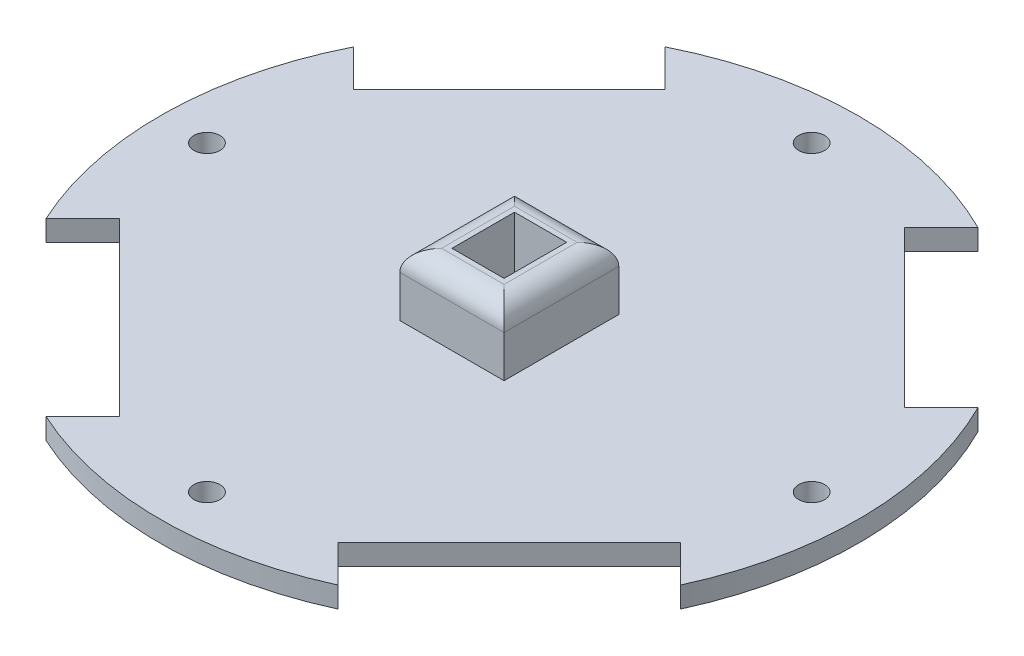
from build123d import *

# Parameters (mm, degrees)
SKETCH1_R           = 67
SKETCH1_R_2         = 2.5
BOSS_EXTRUDE1_DEPTH = 4
SKETCH2_R           = 2
CUT_EXTRUDE1_DEPTH  = 4
SKETCH4_W           = 20
SKETCH4_H           = 22
SKETCH4_W_2         = 10
SKETCH4_H_2         = 12
BOSS_EXTRUDE2_DEPTH = 12
FILLET1_R           = 4
FILLET2_R           = 3
CUT_EXTRUDE2_START  = -10
CUT_EXTRUDE2_DEPTH  = 10
SKETCH7_R           = 0.75
CUT_EXTRUDE3_DEPTH  = 10
SKETCH8_W           = 10
SKETCH8_H           = 12
CUT_EXTRUDE4_DEPTH  = 2


with BuildPart() as part:
    # Sketch1 → Boss-Extrude1 (new body)
    with BuildSketch(Plane(origin=(0, 0, 0), x_dir=(1, 0, 0), z_dir=(0, 1, 0))):
        with Locations(Location((0, 0, 0), (0, 0, 270))):
            Circle(SKETCH1_R)
        with Locations(Location((-58, 0, 0), (0, 0, 270))):
            Circle(SKETCH1_R_2, mode=Mode.SUBTRACT)
        with Locations(Location((0, -58, 0), (0, 0, 270))):
            Circle(SKETCH1_R_2, mode=Mode.SUBTRACT)
        with Locations(Location((58, 0, 0), (0, 0, 270))):
            Circle(SKETCH1_R_2, mode=Mode.SUBTRACT)
        with Locations(Location((0, 58, 0), (0, 0, 270))):
            Circle(SKETCH1_R_2, mode=Mode.SUBTRACT)
    extrude(amount=BOSS_EXTRUDE1_DEPTH)

    # Sketch2 → Cut-Extrude1 (cut)
    with BuildSketch(Plane(origin=(0, 4, 0), x_dir=(1, 0, 0), z_dir=(0, 1, 0))):
        with Locations(Location((0, 0, 0), (0, 0, 270))):
            Circle(SKETCH2_R)
    extrude(amount=-CUT_EXTRUDE1_DEPTH, mode=Mode.SUBTRACT)

    # Sketch4 → Boss-Extrude2 (add)
    with BuildSketch(Plane(origin=(0, 4, 0), x_dir=(1, 0, 0), z_dir=(0, 1, 0))):
        Rectangle(SKETCH4_W, SKETCH4_H)
        Rectangle(SKETCH4_W_2, SKETCH4_H_2, mode=Mode.SUBTRACT)
    extrude(amount=BOSS_EXTRUDE2_DEPTH)

    # Fillet1
    fillet1_edges = [part.edges().sort_by_distance(p)[0] for p in [
        (10, 16, 0),
        (0, 16, -11),
        (-10, 16, 0),
        (0, 16, 11),
    ]]
    fillet(fillet1_edges, radius=FILLET1_R)

    # Fillet2
    fillet2_edges = [part.edges().sort_by_distance(p)[0] for p in [
        (0, 0, -2),
    ]]
    fillet(fillet2_edges, radius=FILLET2_R)

    # Sketch5 → Cut-Extrude2 (cut)
    with BuildSketch(Plane(origin=(0, 4, 0), x_dir=(1, 0, 0), z_dir=(0, 1, 0)).offset(CUT_EXTRUDE2_START)):
        with BuildLine():
            Line((59.908263203, 30), (52.837195391, 22.928932188))
            Line((52.837195391, 22.928932188), (22.928932188, 52.837195391))
            Line((22.928932188, 52.837195391), (30, 59.908263203))
            ThreePointArc((30, 59.908263203), (47.376154339, 47.376154339), (59.908263203, 30))
        make_face()
        with BuildLine():
            Line((-59.908263203, 30), (-52.837195391, 22.928932188))
            Line((-52.837195391, 22.928932188), (-22.928932188, 52.837195391))
            Line((-22.928932188, 52.837195391), (-30, 59.908263203))
            ThreePointArc((-30, 59.908263203), (-47.376154339, 47.376154339), (-59.908263203, 30))
        make_face()
        with BuildLine():
            Line((-53.797643362, -20.928932188), (-20.928932188, -53.797643362))
            Line((-20.928932188, -53.797643362), (-28, -60.868711174))
            ThreePointArc((-28, -60.868711174), (-47.376154339, -47.376154339), (-60.868711174, -28))
            Line((-60.868711174, -28), (-53.797643362, -20.928932188))
        make_face()
        with BuildLine():
            Line((53.797643362, -20.928932188), (20.928932188, -53.797643362))
            Line((20.928932188, -53.797643362), (28, -60.868711174))
            ThreePointArc((28, -60.868711174), (47.376154339, -47.376154339), (60.868711174, -28))
            Line((60.868711174, -28), (53.797643362, -20.928932188))
        make_face()
    extrude(amount=CUT_EXTRUDE2_DEPTH, mode=Mode.SUBTRACT)

    # Sketch7 → Cut-Extrude3 (cut)
    with BuildSketch(Plane(origin=(0, 4, 0), x_dir=(1, 0, 0), z_dir=(0, 1, 0))):
        with Locations(Location((0, 4.5, 0), (0, 0, 270))):
            Circle(SKETCH7_R)
        with Locations(Location((0, -4.5, 0), (0, 0, 270))):
            Circle(SKETCH7_R)
    extrude(amount=-CUT_EXTRUDE3_DEPTH, mode=Mode.SUBTRACT)

    # Sketch8 → Cut-Extrude4 (cut)
    with BuildSketch(Plane(origin=(0, 4, 0), x_dir=(1, 0, 0), z_dir=(0, 1, 0))):
        Rectangle(SKETCH8_W, SKETCH8_H)
    extrude(amount=-CUT_EXTRUDE4_DEPTH, mode=Mode.SUBTRACT)


solid = part.part
